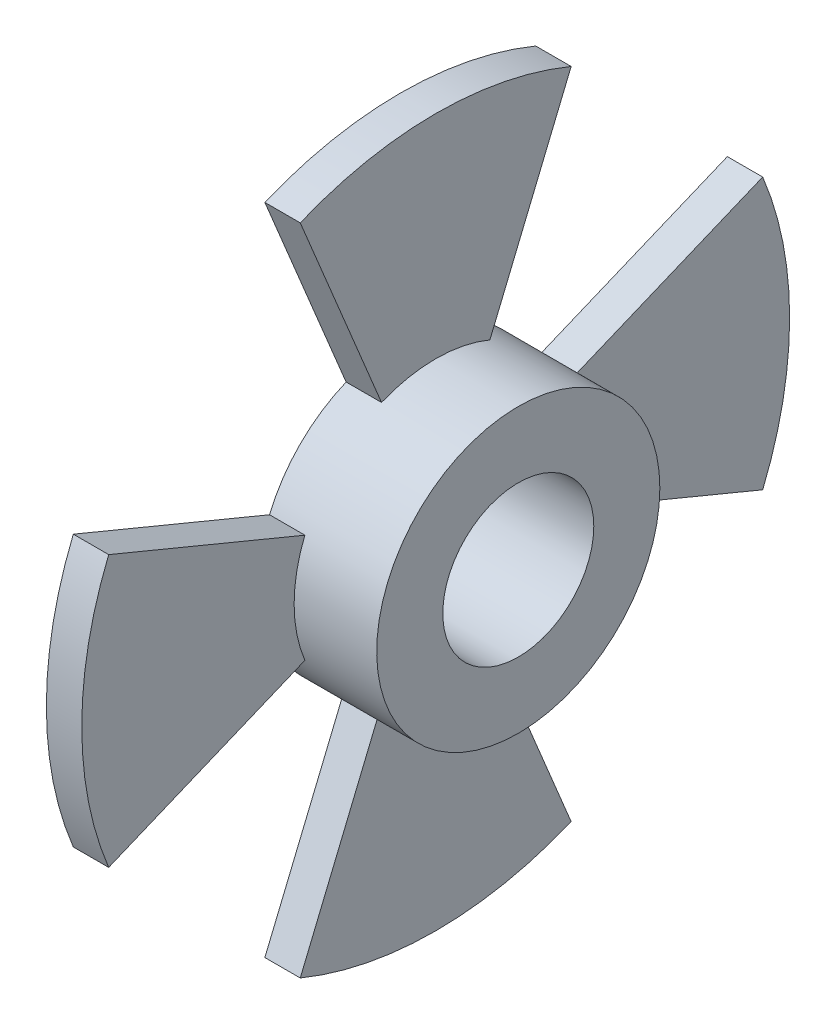
from build123d import *

# Parameters (mm, degrees)
CROQUIS1_R              = 3.2
SALIENTE_EXTRUIR1_DEPTH = 0.75
SALIENTE_EXTRUIR2_START = 3.5
CROQUIS2_R              = 6
CROQUIS2_R_2            = 3.2
SALIENTE_EXTRUIR2_DEPTH = 3.5


with BuildPart() as part:
    # Croquis1 → Saliente-Extruir1 (new, symmetric)
    # profile 1 of 9: a face of its own
    with BuildSketch(Plane(origin=(0, 0, 0), x_dir=(0, 0, -1), z_dir=(1, 0, 0))):
        with BuildLine():
            ThreePointArc((-2.2961005941905754, 5.543277195067705), (-1.1705419320967896, 5.884711682419379), (0, 5.999999999999999))
            Line((0, 6), (0, 15))
            ThreePointArc((9.2e-16, 14.999999999999998), (-2.9263548302419715, 14.711779206048444), (-5.740251485476437, 13.85819298766926))
            Line((-5.740251485476437, 13.858192987669263), (-2.296100594190576, 5.543277195067706))
        make_face()
    # profile 2 of 9: a face of its own
    with BuildSketch(Plane(origin=(0, 0, 0), x_dir=(0, 0, -1), z_dir=(1, 0, 0))):
        with BuildLine():
            Line((0, 15), (0, 6))
            ThreePointArc((3.7e-16, 6), (1.1705419320967503, 5.884711682419386), (2.296100594190503, 5.543277195067735))
            Line((2.2961005941905026, 5.543277195067734), (5.740251485476257, 13.858192987669337))
            ThreePointArc((5.740251485476257, 13.858192987669337), (2.9263548302418774, 14.711779206048465), (1.1e-16, 15))
        make_face()
    # profile 3 of 9: a face of its own
    with BuildSketch(Plane(origin=(0, 0, 0), x_dir=(0, 0, -1), z_dir=(1, 0, 0))):
        with BuildLine():
            Line((13.858192987669264, 5.740251485476436), (5.543277195067706, 2.296100594190575))
            ThreePointArc((5.543277195067704, 2.2961005941905754), (5.884711682419379, 1.1705419320967891), (6, 3.7e-16))
            Line((6, 3.7e-16), (15, 9.2e-16))
            ThreePointArc((14.999999999999998, 0), (14.711779206048446, 2.9263548302419706), (13.858192987669263, 5.740251485476435))
        make_face()
    # profile 4 of 9: a face of its own
    with BuildSketch(Plane(origin=(0, 0, 0), x_dir=(0, 0, -1), z_dir=(1, 0, 0))):
        with BuildLine():
            Line((15, 9.2e-16), (6, 3.7e-16))
            ThreePointArc((6, -1.47e-15), (5.884711682419386, -1.1705419320967514), (5.543277195067735, -2.296100594190503))
            Line((5.543277195067734, -2.296100594190502), (13.858192987669337, -5.740251485476256))
            ThreePointArc((13.858192987669337, -5.740251485476256), (14.711779206048465, -2.9263548302418743), (14.999999999999998, 1.11e-15))
        make_face()
    # profile 5 of 9: a face of its own
    with BuildSketch(Plane(origin=(0, 0, 0), x_dir=(0, 0, -1), z_dir=(1, 0, 0))):
        with BuildLine():
            Line((5.740251485476437, -13.858192987669264), (2.2961005941905754, -5.543277195067704))
            ThreePointArc((2.296100594190576, -5.543277195067706), (1.17054193209679, -5.88471168241938), (9.2e-16, -6.000000000000001))
            Line((9.2e-16, -6), (1.84e-15, -15))
            ThreePointArc((-2.76e-15, -14.999999999999998), (2.9263548302419635, -14.711779206048446), (5.740251485476435, -13.858192987669263))
        make_face()
    # profile 6 of 9: a face of its own
    with BuildSketch(Plane(origin=(0, 0, 0), x_dir=(0, 0, -1), z_dir=(1, 0, 0))):
        with BuildLine():
            ThreePointArc((-1.1e-15, -6), (-1.170541932096751, -5.884711682419386), (-2.2961005941905026, -5.543277195067736))
            Line((-2.2961005941905017, -5.543277195067734), (-5.740251485476255, -13.858192987669337))
            ThreePointArc((-5.740251485476255, -13.858192987669337), (-2.9263548302418756, -14.711779206048465), (1.67e-15, -15))
            Line((1.84e-15, -15), (9.2e-16, -6))
        make_face()
    # profile 7 of 9: a face of its own
    with BuildSketch(Plane(origin=(0, 0, 0), x_dir=(0, 0, -1), z_dir=(1, 0, 0))):
        with BuildLine():
            ThreePointArc((-5.543277195067704, -2.296100594190576), (-5.884711682419379, -1.17054193209679), (-6, -1.1e-15))
            Line((-6, -1.1e-15), (-15, -2.76e-15))
            ThreePointArc((-14.999999999999998, 1.84e-15), (-14.711779206048446, -2.9263548302419706), (-13.858192987669263, -5.740251485476436))
            Line((-13.858192987669264, -5.740251485476437), (-5.543277195067706, -2.296100594190576))
        make_face()
    # profile 8 of 9: a face of its own
    with BuildSketch(Plane(origin=(0, 0, 0), x_dir=(0, 0, -1), z_dir=(1, 0, 0))):
        with BuildLine():
            ThreePointArc((-6, 7.3e-16), (-5.884711682419386, 1.1705419320967507), (-5.543277195067736, 2.296100594190502))
            Line((-5.543277195067736, 2.296100594190502), (-13.858192987669339, 5.7402514854762545))
            ThreePointArc((-13.85819298766934, 5.740251485476255), (-14.711779206048467, 2.9263548302418747), (-15.000000000000002, -3.22e-15))
            Line((-15, -2.76e-15), (-6, -1.1e-15))
        make_face()
    # profile 9 of 9: a face of its own
    with BuildSketch(Plane(origin=(0, 0, 0), x_dir=(0, 0, -1), z_dir=(1, 0, 0))):
        with BuildLine():
            ThreePointArc((2.296100594190503, 5.543277195067735), (1.1705419320967503, 5.884711682419386), (3.7e-16, 6))
            ThreePointArc((0, 5.999999999999999), (-1.1705419320967896, 5.884711682419379), (-2.2961005941905754, 5.543277195067705))
            ThreePointArc((-2.2961005941905763, 5.543277195067705), (-3.3334213981176317, 4.98881767381526), (-4.2426406871192865, 4.242640687119284))
            ThreePointArc((-4.242640687119286, 4.242640687119283), (-4.988817673815284, 3.333421398117596), (-5.543277195067734, 2.2961005941905004))
            ThreePointArc((-5.543277195067736, 2.296100594190502), (-5.884711682419386, 1.1705419320967507), (-6, 7.3e-16))
            ThreePointArc((-6, -1.1e-15), (-5.884711682419379, -1.17054193209679), (-5.543277195067704, -2.296100594190576))
            ThreePointArc((-5.543277195067706, -2.2961005941905746), (-4.9888176738152605, -3.333421398117629), (-4.242640687119286, -4.242640687119285))
            ThreePointArc((-4.242640687119285, -4.242640687119287), (-3.333421398117597, -4.988817673815285), (-2.2961005941905013, -5.543277195067736))
            ThreePointArc((-2.2961005941905026, -5.543277195067736), (-1.170541932096751, -5.884711682419386), (-1.1e-15, -6))
            ThreePointArc((9.2e-16, -6.000000000000001), (1.17054193209679, -5.88471168241938), (2.296100594190576, -5.543277195067706))
            ThreePointArc((2.296100594190574, -5.543277195067706), (3.333421398117629, -4.9888176738152605), (4.242640687119284, -4.242640687119286))
            ThreePointArc((4.2426406871192865, -4.242640687119285), (4.988817673815282, -3.333421398117596), (5.543277195067736, -2.296100594190502))
            ThreePointArc((5.543277195067735, -2.296100594190503), (5.884711682419386, -1.1705419320967514), (6, -1.47e-15))
            ThreePointArc((6, 3.7e-16), (5.884711682419379, 1.1705419320967891), (5.543277195067704, 2.2961005941905754))
            ThreePointArc((5.543277195067705, 2.2961005941905754), (4.9888176738152605, 3.333421398117629), (4.242640687119286, 4.242640687119284))
            ThreePointArc((4.242640687119287, 4.2426406871192865), (3.333421398117599, 4.988817673815284), (2.2961005941905035, 5.543277195067736))
        make_face()
        Circle(CROQUIS1_R, mode=Mode.SUBTRACT)
    extrude(amount=SALIENTE_EXTRUIR1_DEPTH, both=True)

    # Croquis2 → Saliente-Extruir2 (add)
    with BuildSketch(Plane(origin=(0.75, 0, 0), x_dir=(0, 0, -1), z_dir=(1, 0, 0)).offset(SALIENTE_EXTRUIR2_START)):
        with Locations(Location((0, 0, 0), (0, 0, 157.5))):
            Circle(CROQUIS2_R)
        Circle(CROQUIS2_R_2, mode=Mode.SUBTRACT)
    extrude(amount=-SALIENTE_EXTRUIR2_DEPTH)


solid = part.part
